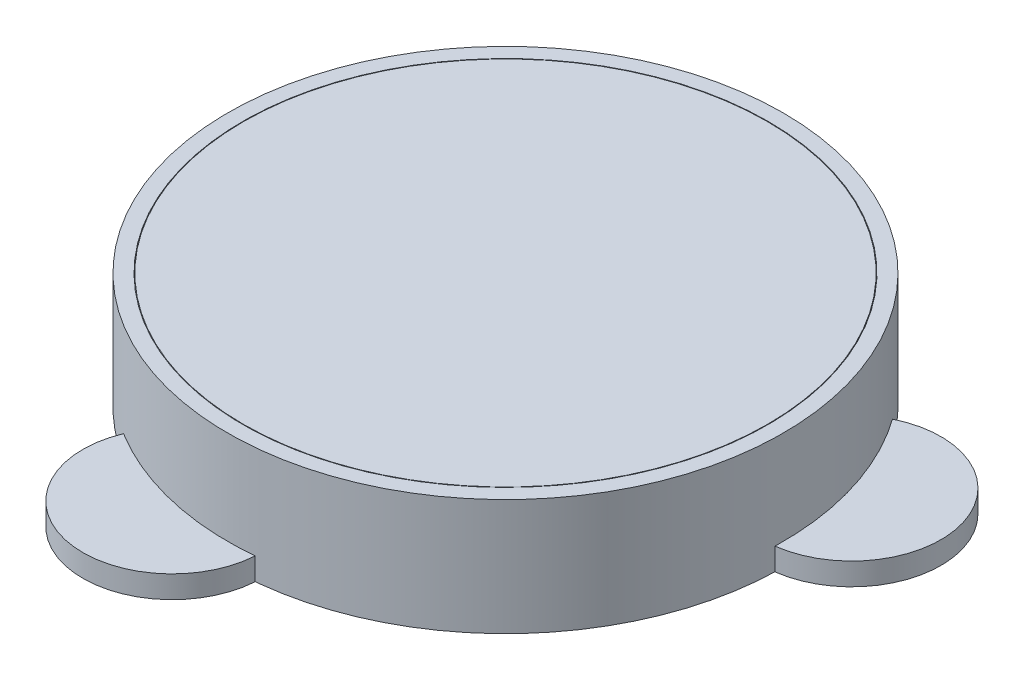
from build123d import *

# Parameters (mm, degrees)
SKETCH1_R             = 17.5
BOSS_EXTRUDE1_DEPTH   = 2
SKETCH2_R             = 17.5
BOSS_EXTRUDE2_DEPTH   = 0.1
SKETCH3_R             = 17.4
BOSS_EXTRUDE3_DEPTH   = 2.5
SKETCH4_R             = 17.5
BOSS_EXTRUDE4_DEPTH   = 1.2
SKETCH5_R             = 17.6
BOSS_EXTRUDE5_DEPTH   = 2
SKETCH6_R             = 18.638737407
SKETCH6_R_2           = 17.638737407
BOSS_EXTRUDE7_DEPTH   = 7.8
BOSS_EXTRUDE8_DEPTH   = 1.5
BOSS_EXTRUDE8_2_DEPTH = 1.5
BOSS_EXTRUDE8_3_DEPTH = 1.5
BOSS_EXTRUDE9_START   = -2
BOSS_EXTRUDE9_DEPTH   = 1.5
BOSS_EXTRUDE9_2_DEPTH = 1.5
BOSS_EXTRUDE9_3_DEPTH = 1.5
BOSS_EXTRUDE9_4_DEPTH = 1.5
BOSS_EXTRUDE9_5_DEPTH = 1.5


with BuildPart() as part:
    # Sketch1 → Boss-Extrude1 (new body)
    with BuildSketch(Plane(origin=(0, 0, 0), x_dir=(1, 0, 0), z_dir=(0, 1, 0))):
        with Locations(Location((0, 0, 0), (0, 0, 270))):
            Circle(SKETCH1_R)
    extrude(amount=BOSS_EXTRUDE1_DEPTH)

    # Sketch2 → Boss-Extrude2 (add)
    with BuildSketch(Plane(origin=(0, 2, 0), x_dir=(1, 0, 0), z_dir=(0, 1, 0))):
        with Locations(Location((0, 0, 0), (0, 0, 270))):
            Circle(SKETCH2_R)
    extrude(amount=BOSS_EXTRUDE2_DEPTH)

    # Sketch3 → Boss-Extrude3 (add)
    with BuildSketch(Plane(origin=(0, 2.1, 0), x_dir=(1, 0, 0), z_dir=(0, 1, 0))):
        with Locations(Location((0, 0, 0), (0, 0, 270))):
            Circle(SKETCH3_R)
    extrude(amount=BOSS_EXTRUDE3_DEPTH)

    # Sketch4 → Boss-Extrude4 (add)
    with BuildSketch(Plane(origin=(0, 4.6, 0), x_dir=(1, 0, 0), z_dir=(0, 1, 0))):
        with Locations(Location((0, 0, 0), (0, 0, 270))):
            Circle(SKETCH4_R)
    extrude(amount=BOSS_EXTRUDE4_DEPTH)

    # Sketch5 → Boss-Extrude5 (add)
    with BuildSketch(Plane(origin=(0, 5.8, 0), x_dir=(1, 0, 0), z_dir=(0, 1, 0))):
        with Locations(Location((0, 0, 0), (0, 0, 270))):
            Circle(SKETCH5_R)
    extrude(amount=BOSS_EXTRUDE5_DEPTH)


with BuildPart() as body_2:
    # Sketch6 → Boss-Extrude7 (new body)
    with BuildSketch(Plane.XZ):
        with Locations(Location((0, 0, 0), (0, 0, 270))):
            Circle(SKETCH6_R)
        with Locations(Location((0, 0, 0), (0, 0, 270))):
            Circle(SKETCH6_R_2, mode=Mode.SUBTRACT)
    extrude(amount=-BOSS_EXTRUDE7_DEPTH)


with BuildPart() as body_3:
    # Sketch7 → Boss-Extrude8 (new body)
    with BuildSketch(Plane(origin=(0, 0, 0), x_dir=(-1, 0, 0), z_dir=(0, -1, 0))):
        with BuildLine():
            ThreePointArc((16.946626552, 7.759792564), (17.982185174, 16.843645609), (8.850091423, 16.403609784))
            ThreePointArc((8.850091423, 16.403609784), (13.603181929, 12.741898349), (16.946626552, 7.759792564))
        make_face()
    extrude(amount=-BOSS_EXTRUDE8_DEPTH)


with BuildPart() as body_4:
    # Sketch7 → Boss-Extrude8 2 (new body)
    with BuildSketch(Plane(origin=(0, 0, 0), x_dir=(-1, 0, 0), z_dir=(0, -1, 0))):
        with BuildLine():
            ThreePointArc((-18.630988498, -0.537400894), (-17.836398627, 5.409751949), (-15.193490764, 10.796312821))
            ThreePointArc((-15.193490764, 10.796312821), (-23.578117576, 7.151206371), (-18.630988498, -0.537400894))
        make_face()
    extrude(amount=-BOSS_EXTRUDE8_2_DEPTH)


with BuildPart() as body_5:
    # Sketch7 → Boss-Extrude8 3 (new body)
    with BuildSketch(Plane(origin=(0, 0, 0), x_dir=(-1, 0, 0), z_dir=(0, -1, 0))):
        with BuildLine():
            ThreePointArc((-1.753135788, -18.556105384), (5.595932403, -23.99485198), (9.780897075, -15.86620889))
            ThreePointArc((9.780897075, -15.86620889), (4.233216698, -18.151650297), (-1.753135788, -18.556105384))
        make_face()
    extrude(amount=-BOSS_EXTRUDE8_3_DEPTH)


with BuildPart() as body_6:
    # Sketch9 → Boss-Extrude9 (new body)
    with BuildSketch(Plane(origin=(0, 7.8, 0), x_dir=(1, 0, 0), z_dir=(0, 1, 0)).offset(BOSS_EXTRUDE9_START)):
        with BuildLine():
            Line((-17.61, 0), (-17.6, 0))
            ThreePointArc((-17.6, 0), (-16.738594687, 5.438699101), (-14.238699101, 10.34502044))
            Line((-14.238699101, 10.34502044), (-14.246789271, 10.350898293))
            ThreePointArc((-14.246789271, 10.350898293), (-16.748105252, 5.441789271), (-17.61, 0))
        make_face()
    extrude(amount=-BOSS_EXTRUDE9_DEPTH)


with BuildPart() as body_7:
    # Sketch9 → Boss-Extrude9 2 (new body)
    with BuildSketch(Plane(origin=(0, 7.8, 0), x_dir=(1, 0, 0), z_dir=(0, 1, 0)).offset(BOSS_EXTRUDE9_START)):
        with BuildLine():
            Line((-5.441789271, 16.748105252), (-5.438699101, 16.738594687))
            ThreePointArc((-5.438699101, 16.738594687), (0, 17.6), (5.438699101, 16.738594687))
            Line((5.438699101, 16.738594687), (5.441789271, 16.748105252))
            ThreePointArc((5.441789271, 16.748105252), (0, 17.61), (-5.441789271, 16.748105252))
        make_face()
    extrude(amount=-BOSS_EXTRUDE9_2_DEPTH)


with BuildPart() as body_8:
    # Sketch9 → Boss-Extrude9 3 (new body)
    with BuildSketch(Plane(origin=(0, 7.8, 0), x_dir=(1, 0, 0), z_dir=(0, 1, 0)).offset(BOSS_EXTRUDE9_START)):
        with BuildLine():
            Line((14.246789271, 10.350898293), (14.238699101, 10.34502044))
            ThreePointArc((14.238699101, 10.34502044), (16.738594687, 5.438699101), (17.6, 0))
            Line((17.6, 0), (17.61, 0))
            ThreePointArc((17.61, 0), (16.748105252, 5.441789271), (14.246789271, 10.350898293))
        make_face()
    extrude(amount=-BOSS_EXTRUDE9_3_DEPTH)


with BuildPart() as body_9:
    # Sketch9 → Boss-Extrude9 4 (new body)
    with BuildSketch(Plane(origin=(0, 7.8, 0), x_dir=(1, 0, 0), z_dir=(0, 1, 0)).offset(BOSS_EXTRUDE9_START)):
        with BuildLine():
            Line((14.246789271, -10.350898293), (14.238699101, -10.34502044))
            ThreePointArc((14.238699101, -10.34502044), (10.34502044, -14.238699101), (5.438699101, -16.738594687))
            Line((5.438699101, -16.738594687), (5.441789271, -16.748105252))
            ThreePointArc((5.441789271, -16.748105252), (10.350898293, -14.246789271), (14.246789271, -10.350898293))
        make_face()
    extrude(amount=-BOSS_EXTRUDE9_4_DEPTH)


with BuildPart() as body_10:
    # Sketch9 → Boss-Extrude9 5 (new body)
    with BuildSketch(Plane(origin=(0, 7.8, 0), x_dir=(1, 0, 0), z_dir=(0, 1, 0)).offset(BOSS_EXTRUDE9_START)):
        with BuildLine():
            Line((-5.441789271, -16.748105252), (-5.438699101, -16.738594687))
            ThreePointArc((-5.438699101, -16.738594687), (-10.34502044, -14.238699101), (-14.238699101, -10.34502044))
            Line((-14.238699101, -10.34502044), (-14.246789271, -10.350898293))
            ThreePointArc((-14.246789271, -10.350898293), (-10.350898293, -14.246789271), (-5.441789271, -16.748105252))
        make_face()
    extrude(amount=-BOSS_EXTRUDE9_5_DEPTH)


solid = Compound([part.part, body_2.part, body_3.part, body_4.part, body_5.part, body_6.part, body_7.part, body_8.part, body_9.part, body_10.part])
